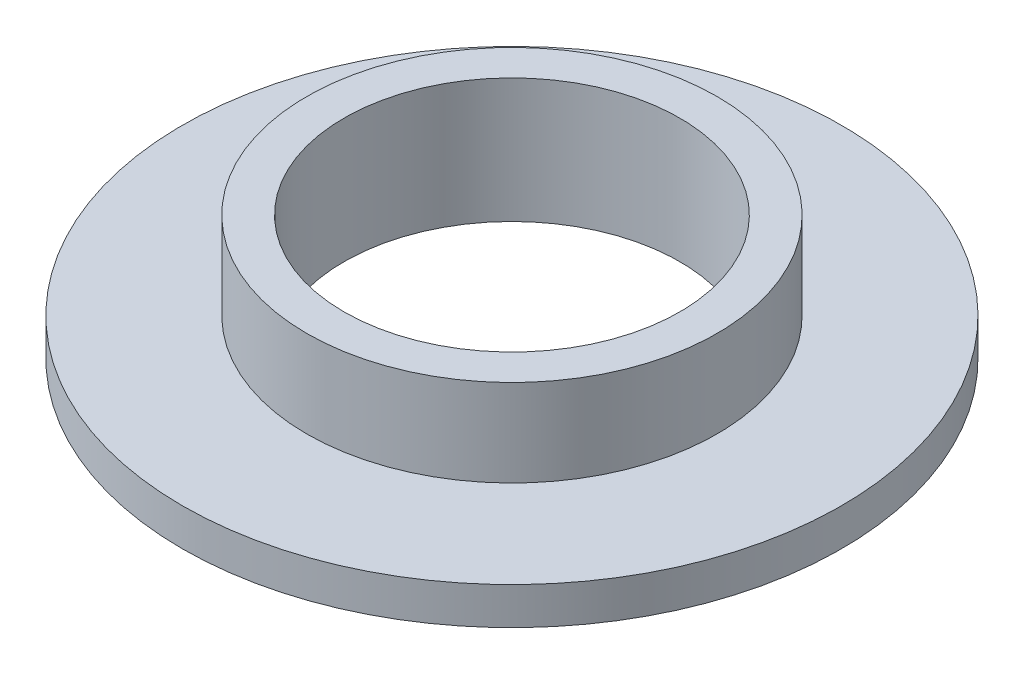
from build123d import *

# Parameters (mm, degrees)
SKETCH1_R           = 16.5
SKETCH1_R_2         = 13.5
BOSS_EXTRUDE1_DEPTH = 10
SKETCH1_3_R         = 26.5
SKETCH1_3_R_2       = 16.5
BOSS_EXTRUDE2_DEPTH = 3


with BuildPart() as part:
    # Sketch1 → Boss-Extrude1 (new body)
    with BuildSketch(Plane(origin=(0, 0, 0), x_dir=(1, 0, 0), z_dir=(0, 1, 0))):
        Circle(SKETCH1_R)
        Circle(SKETCH1_R_2, mode=Mode.SUBTRACT)
    extrude(amount=BOSS_EXTRUDE1_DEPTH)

    # Sketch1<3> → Boss-Extrude2 (add)
    with BuildSketch(Plane(origin=(0, 0, 0), x_dir=(1, 0, 0), z_dir=(0, 1, 0))):
        Circle(SKETCH1_3_R)
        Circle(SKETCH1_3_R_2, mode=Mode.SUBTRACT)
    extrude(amount=BOSS_EXTRUDE2_DEPTH)


solid = part.part
